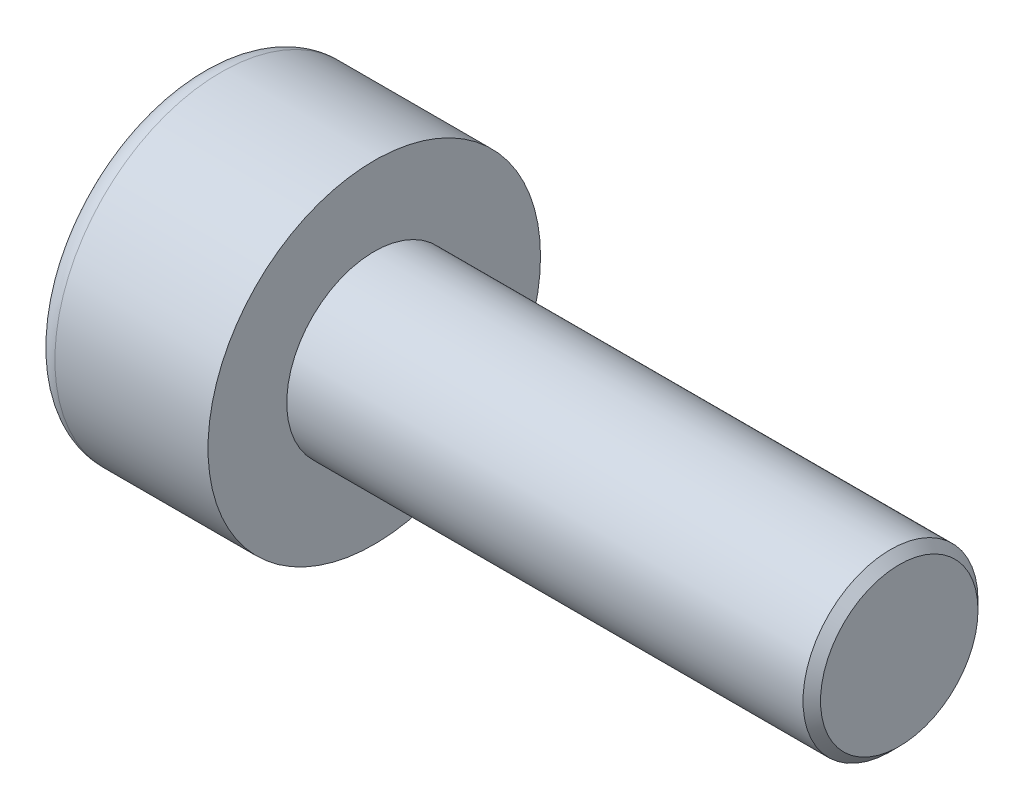
from build123d import *

# Parameters (mm, degrees)
SKETCH1_R           = 1.9
BASEHEAD_DEPTH      = 2
SKETCH2_R           = 1
BASEBODY_DEPTH      = 6
HEXAGONSOCKET_DEPTH = 1
TOPFILLET_R         = 0.25
CHAMFER1_SIZE       = 0.1


with BuildPart() as part:
    # Sketch1 → BaseHead (new body)
    with BuildSketch(Plane(origin=(0, 0, 0), x_dir=(0, 0, -1), z_dir=(1, 0, 0))):
        Circle(SKETCH1_R)
    extrude(amount=BASEHEAD_DEPTH)

    # Sketch2 → BaseBody (add)
    with BuildSketch(Plane(origin=(2, 0, 0), x_dir=(0, 0, -1), z_dir=(1, 0, 0))):
        Circle(SKETCH2_R)
    extrude(amount=BASEBODY_DEPTH)

    # Sketch3 → HexagonSocket (cut)
    with BuildSketch(Plane(origin=(0, 0, 0), x_dir=(0, 0, -1), z_dir=(1, 0, 0))):
        Polygon((0.866025404, 0), (0.433012702, 0.75), (-0.433012702, 0.75), (-0.866025404, 0), (-0.433012702, -0.75), (0.433012702, -0.75), align=None)
    extrude(amount=HEXAGONSOCKET_DEPTH, mode=Mode.SUBTRACT)

    # Sketch4 → Cut-Revolve1 (revolve, cut)
    with BuildSketch(Plane(origin=(-4.19613823, 0.75, 0), x_dir=(-1, 0, 0), z_dir=(0, 0, 1)), mode=Mode.PRIVATE) as cut_revolve1_sk:
        Polygon((-5.19613823, 1.5), (-5.629150931, 0.75), (-5.19613823, 0.75), align=None)
    revolve(cut_revolve1_sk.sketch.rotate(Axis((0.838992387, 0, 0), (-1, 0, 0)), 90), axis=Axis((0.838992387, 0, 0), (-1, 0, 0)), mode=Mode.SUBTRACT)

    # TopFillet
    topfillet_edges = [part.edges().sort_by_distance(p)[0] for p in [
        (0, 0, 1.9),
    ]]
    fillet(topfillet_edges, radius=TOPFILLET_R)

    # Chamfer1
    chamfer1_edges = [part.edges().sort_by_distance(p)[0] for p in [
        (8, 0, 1),
    ]]
    chamfer(chamfer1_edges, length=CHAMFER1_SIZE)


solid = part.part
